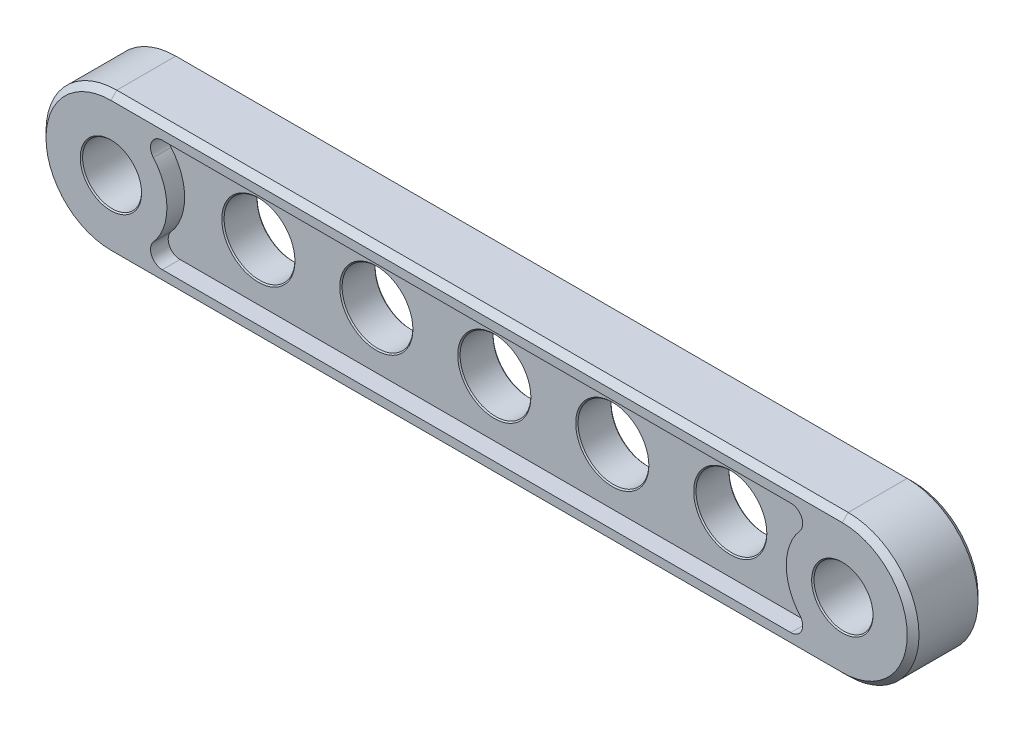
from build123d import *

# Parameters (mm, degrees)
SKETCH1_R           = 2.5
BOSS_EXTRUDE1_DEPTH = 3
SKETCH1_3_R         = 3
BOSS_EXTRUDE2_DEPTH = 1.5
CHAMFER1_SIZE       = 0.5
CHAMFER3_SIZE       = 0.1


with BuildPart() as part:
    # Sketch1 → Boss-Extrude1 (new, symmetric)
    with BuildSketch(Plane.XY):
        with BuildLine():
            Line((-31, -6), (31, -6))
            ThreePointArc((31, -6), (37, 0), (31, 6))
            Line((31, 6), (-31, 6))
            ThreePointArc((-31, 6), (-37, 0), (-31, -6))
        make_face()
        with Locations((31, 0)):
            Circle(SKETCH1_R, mode=Mode.SUBTRACT)
        with Locations((-31, 0)):
            Circle(SKETCH1_R, mode=Mode.SUBTRACT)
        with BuildLine():
            ThreePointArc((26.641101056, -4.75), (27.549994316, -4.167028828), (27.399170438, -3.097826087))
            ThreePointArc((27.399170438, -3.097826087), (26.25, 0), (27.399170438, 3.097826087))
            ThreePointArc((27.399170438, 3.097826087), (27.549994316, 4.167028828), (26.641101056, 4.75))
            Line((26.641101056, 4.75), (-26.641101056, 4.75))
            ThreePointArc((-26.641101056, 4.75), (-27.549994316, 4.167028828), (-27.399170438, 3.097826087))
            ThreePointArc((-27.399170438, 3.097826087), (-26.25, 0), (-27.399170438, -3.097826087))
            ThreePointArc((-27.399170438, -3.097826087), (-27.549994316, -4.167028828), (-26.641101056, -4.75))
            Line((-26.641101056, -4.75), (26.641101056, -4.75))
        make_face(mode=Mode.SUBTRACT)
    extrude(amount=BOSS_EXTRUDE1_DEPTH, both=True)

    # Sketch1<3> → Boss-Extrude2 (add, symmetric)
    with BuildSketch(Plane.XY):
        with BuildLine():
            Line((-26.641101056, -4.75), (26.641101056, -4.75))
            ThreePointArc((26.641101056, -4.75), (27.549994316, -4.167028828), (27.399170438, -3.097826087))
            ThreePointArc((27.399170438, -3.097826087), (26.25, 0), (27.399170438, 3.097826087))
            ThreePointArc((27.399170438, 3.097826087), (27.549994316, 4.167028828), (26.641101056, 4.75))
            Line((26.641101056, 4.75), (-26.641101056, 4.75))
            ThreePointArc((-26.641101056, 4.75), (-27.549994316, 4.167028828), (-27.399170438, 3.097826087))
            ThreePointArc((-27.399170438, 3.097826087), (-26.25, 0), (-27.399170438, -3.097826087))
            ThreePointArc((-27.399170438, -3.097826087), (-27.549994316, -4.167028828), (-26.641101056, -4.75))
        make_face()
        Circle(SKETCH1_3_R, mode=Mode.SUBTRACT)
        with Locations((10, 0)):
            Circle(SKETCH1_3_R, mode=Mode.SUBTRACT)
        with Locations((20, 0)):
            Circle(SKETCH1_3_R, mode=Mode.SUBTRACT)
        with Locations((-10, 0)):
            Circle(SKETCH1_3_R, mode=Mode.SUBTRACT)
        with Locations((-20, 0)):
            Circle(SKETCH1_3_R, mode=Mode.SUBTRACT)
    extrude(amount=BOSS_EXTRUDE2_DEPTH, both=True)

    # Chamfer1
    chamfer1_edges = [part.edges().sort_by_distance(p)[0] for p in [
        (-37, 0, -3),
        (0, 6, -3),
        (37, 0, -3),
        (0, -6, -3),
        (0, -6, 3),
        (37, 0, 3),
        (0, 6, 3),
        (-37, 0, 3),
    ]]
    chamfer(chamfer1_edges, length=CHAMFER1_SIZE)

    # Chamfer3
    chamfer3_edges = [part.edges().sort_by_distance(p)[0] for p in [
        (-33.5, 0, -3),
        (28.5, 0, -3),
        (28.5, 0, 3),
        (-33.5, 0, 3),
        (-23, 0, 1.5),
        (-13, 0, 1.5),
        (17, 0, 1.5),
        (7, 0, 1.5),
        (-3, 0, 1.5),
        (-3, 0, -1.5),
        (7, 0, -1.5),
        (17, 0, -1.5),
        (-13, 0, -1.5),
        (-23, 0, -1.5),
    ]]
    chamfer(chamfer3_edges, length=CHAMFER3_SIZE)


solid = part.part
